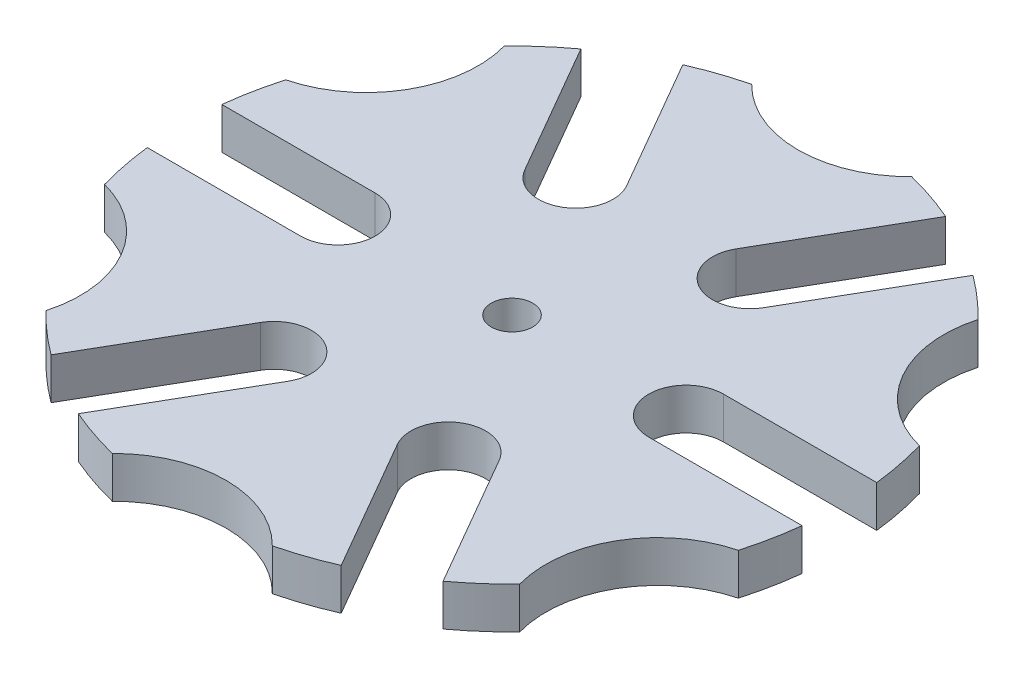
from build123d import *

# Parameters (mm, degrees)
EXTRUDE_2_DEPTH     = 10
SCALE_2_SCALE       = 3
SKETCH_5_W          = 154.243752884
SKETCH_5_H          = 20
CUT_EXTRUDE_1_DEPTH = 113.5
SKETCH_6_R          = 5
CUT_EXTRUDE_2_DEPTH = 113.5


with BuildPart() as part:
    # 草图4 → 凸台-拉伸2 (new body)
    with BuildSketch(Plane(origin=(0, 0, 0), x_dir=(1, 0, 0), z_dir=(0, 1, 0))):
        with BuildLine():
            ThreePointArc((-13.678571429, 2.982730909), (-12.124355653, 7), (-9.422406454, 10.35462489))
            ThreePointArc((-9.422406454, 10.35462489), (-9.513861615, 10.487132461), (-9.598076211, 10.624355653))
            Line((-9.598076211, 10.624355653), (-15.762896757, 21.302138058))
            ThreePointArc((-15.762896757, 21.302138058), (-17.464105133, 19.93125766), (-19.046604272, 18.424897983))
            ThreePointArc((-19.046604272, 18.424897983), (-18.7975102, 17.224138351), (-18.71396178, 16.000663294))
            ThreePointArc((-18.71396178, 16.000663294), (-20.603825728, 10.482877024), (-25.479731852, 7.282394164))
            ThreePointArc((-25.479731852, 7.282394164), (-25.993028029, 5.158729869), (-26.329641091, 3))
            Line((-26.329641091, 3), (-14, 3))
            ThreePointArc((-14, 3), (-13.839053931, 2.995679616), (-13.678571429, 2.982730909))
        make_face()
        with BuildLine():
            ThreePointArc((13.678571429, -2.982730909), (11.767928573, -2.004459314), (11, 0))
            Line((11, 0), (0, 0))
            Line((0, 0), (12.124355653, 7))
            ThreePointArc((12.124355653, 7), (10.903170014, 8.781849671), (9.422406454, 10.35462489))
            ThreePointArc((9.422406454, 10.35462489), (5.5, 9.526279442), (4.256164975, 13.337355799))
            ThreePointArc((4.256164975, 13.337355799), (0, 14), (-4.256164975, 13.337355799))
            ThreePointArc((-4.256164975, 13.337355799), (-4.064739784, 12.744232626), (-4, 12.124355653))
            ThreePointArc((-4, 12.124355653), (-6.069199098, 9.272407252), (-9.422406454, 10.35462489))
            ThreePointArc((-9.422406454, 10.35462489), (-12.124355653, 7), (-13.678571429, 2.982730909))
            ThreePointArc((-13.678571429, 2.982730909), (-11.767928573, 2.004459314), (-11, 0))
            ThreePointArc((-11, 0), (-11.767928573, -2.004459314), (-13.678571429, -2.982730909))
            ThreePointArc((-13.678571429, -2.982730909), (-12.124355653, -7), (-9.422406454, -10.35462489))
            ThreePointArc((-9.422406454, -10.35462489), (-6.069199098, -9.272407252), (-4, -12.124355653))
            ThreePointArc((-4, -12.124355653), (-4.064739784, -12.744232626), (-4.256164975, -13.337355799))
            ThreePointArc((-4.256164975, -13.337355799), (0, -14), (4.256164975, -13.337355799))
            ThreePointArc((4.256164975, -13.337355799), (5.5, -9.526279442), (9.422406454, -10.35462489))
            ThreePointArc((9.422406454, -10.35462489), (12.124355653, -7), (13.678571429, -2.982730909))
        make_face()
        with BuildLine():
            ThreePointArc((-4.256164975, 13.337355799), (0, 14), (4.256164975, 13.337355799))
            ThreePointArc((4.256164975, 13.337355799), (4.325192316, 13.482812077), (4.401923789, 13.624355653))
            Line((4.401923789, 13.624355653), (10.566744334, 24.302138058))
            ThreePointArc((10.566744334, 24.302138058), (8.528922897, 25.089987529), (6.433127579, 25.707292147))
            ThreePointArc((6.433127579, 25.707292147), (0, 23.001326589), (-6.433127579, 25.707292147))
            ThreePointArc((-6.433127579, 25.707292147), (-8.528922897, 25.089987529), (-10.566744334, 24.302138058))
            Line((-10.566744334, 24.302138058), (-4.401923789, 13.624355653))
            ThreePointArc((-4.401923789, 13.624355653), (-4.325192316, 13.482812077), (-4.256164975, 13.337355799))
        make_face()
        with BuildLine():
            ThreePointArc((9.422406454, 10.35462489), (10.903170014, 8.781849671), (12.124355653, 7))
            Line((12.124355653, 7), (19.919733146, 11.500663294))
            ThreePointArc((19.919733146, 11.500663294), (18.784672274, 14.874701965), (19.046604272, 18.424897983))
            ThreePointArc((19.046604272, 18.424897983), (17.464105133, 19.93125766), (15.762896757, 21.302138058))
            Line((15.762896757, 21.302138058), (9.598076211, 10.624355653))
            ThreePointArc((9.598076211, 10.624355653), (9.513861615, 10.487132461), (9.422406454, 10.35462489))
        make_face()
        with BuildLine():
            ThreePointArc((12.124355653, 7), (13.056889914, 5.051497379), (13.678571429, 2.982730909))
            ThreePointArc((13.678571429, 2.982730909), (13.839053931, 2.995679616), (14, 3))
            Line((14, 3), (26.329641091, 3))
            ThreePointArc((26.329641091, 3), (25.993028029, 5.158729869), (25.479731852, 7.282394164))
            ThreePointArc((25.479731852, 7.282394164), (22.274205913, 8.830652409), (19.919733146, 11.500663294))
            Line((19.919733146, 11.500663294), (12.124355653, 7))
        make_face()
        with BuildLine():
            ThreePointArc((14, -3), (13.839053931, -2.995679616), (13.678571429, -2.982730909))
            ThreePointArc((13.678571429, -2.982730909), (12.124355653, -7), (9.422406454, -10.35462489))
            ThreePointArc((9.422406454, -10.35462489), (9.513861615, -10.487132461), (9.598076211, -10.624355653))
            Line((9.598076211, -10.624355653), (15.762896757, -21.302138058))
            ThreePointArc((15.762896757, -21.302138058), (17.464105133, -19.93125766), (19.046604272, -18.424897983))
            ThreePointArc((19.046604272, -18.424897983), (19.919733146, -11.500663294), (25.479731852, -7.282394164))
            ThreePointArc((25.479731852, -7.282394164), (25.993028029, -5.158729869), (26.329641091, -3))
            Line((26.329641091, -3), (14, -3))
        make_face()
        with BuildLine():
            ThreePointArc((4.401923789, -13.624355653), (4.325192316, -13.482812077), (4.256164975, -13.337355799))
            ThreePointArc((4.256164975, -13.337355799), (0, -14), (-4.256164975, -13.337355799))
            ThreePointArc((-4.256164975, -13.337355799), (-4.325192316, -13.482812077), (-4.401923789, -13.624355653))
            Line((-4.401923789, -13.624355653), (-10.566744334, -24.302138058))
            ThreePointArc((-10.566744334, -24.302138058), (-8.528922897, -25.089987529), (-6.433127579, -25.707292147))
            ThreePointArc((-6.433127579, -25.707292147), (0, -23.001326589), (6.433127579, -25.707292147))
            ThreePointArc((6.433127579, -25.707292147), (8.528922897, -25.089987529), (10.566744334, -24.302138058))
            Line((10.566744334, -24.302138058), (4.401923789, -13.624355653))
        make_face()
        with BuildLine():
            ThreePointArc((-9.598076211, -10.624355653), (-9.513861615, -10.487132461), (-9.422406454, -10.35462489))
            ThreePointArc((-9.422406454, -10.35462489), (-12.124355653, -7), (-13.678571429, -2.982730909))
            ThreePointArc((-13.678571429, -2.982730909), (-13.839053931, -2.995679616), (-14, -3))
            Line((-14, -3), (-26.329641091, -3))
            ThreePointArc((-26.329641091, -3), (-25.993028029, -5.158729869), (-25.479731852, -7.282394164))
            ThreePointArc((-25.479731852, -7.282394164), (-20.603825728, -10.482877024), (-18.71396178, -16.000663294))
            ThreePointArc((-18.71396178, -16.000663294), (-18.7975102, -17.224138351), (-19.046604272, -18.424897983))
            ThreePointArc((-19.046604272, -18.424897983), (-17.464105133, -19.93125766), (-15.762896757, -21.302138058))
            Line((-15.762896757, -21.302138058), (-9.598076211, -10.624355653))
        make_face()
        with BuildLine():
            Line((0, 0), (11, 0))
            ThreePointArc((11, 0), (11.767928573, 2.004459314), (13.678571429, 2.982730909))
            ThreePointArc((13.678571429, 2.982730909), (13.056889914, 5.051497379), (12.124355653, 7))
            Line((12.124355653, 7), (0, 0))
        make_face()
    extrude(amount=EXTRUDE_2_DEPTH)


with BuildPart() as part_1:
    # 缩放比例2: scaled about (0, 5, 0)
    add(part.part.scale(SCALE_2_SCALE).moved(Location((0, -10, 0))))

    # 草图5 → 切除-拉伸1 (cut, symmetric)
    with BuildSketch(Plane(origin=(0, 0, 0), x_dir=(0, 0, -1), z_dir=(1, 0, 0))):
        with Locations((0, 10)):
            Rectangle(SKETCH_5_W, SKETCH_5_H)
    extrude(amount=CUT_EXTRUDE_1_DEPTH, both=True, mode=Mode.SUBTRACT)

    # 草图6 → 切除-拉伸2 (cut, symmetric)
    with BuildSketch(Plane.XZ.offset(10)):
        with Locations(Location((0, 0, 0), (0, 0, 270))):
            Circle(SKETCH_6_R)
    extrude(amount=CUT_EXTRUDE_2_DEPTH, both=True, mode=Mode.SUBTRACT)


solid = part_1.part
